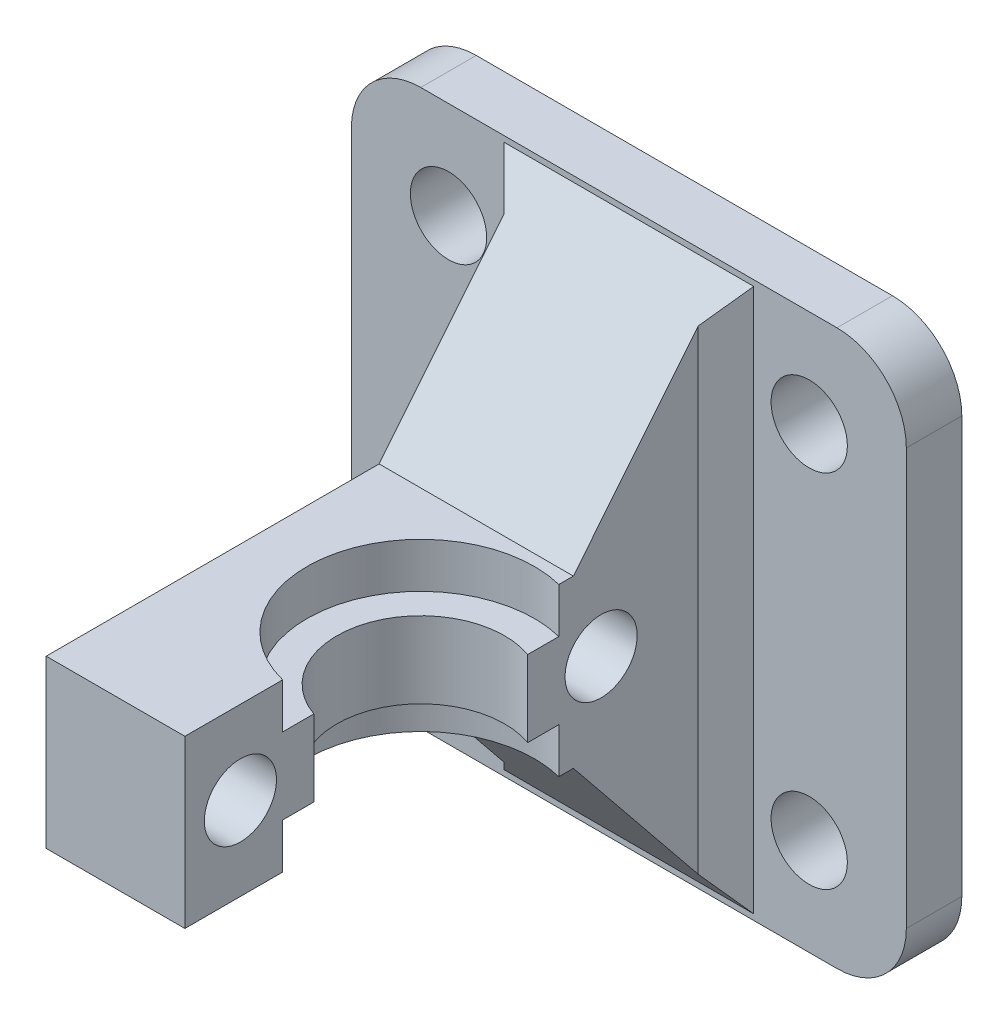
from build123d import *
from OCP.BRepFilletAPI import BRepFilletAPI_MakeChamfer

# Parameters (mm, degrees)
SKETCH1_W           = 40
SKETCH1_H           = 40
BOSS_EXTRUDE1_DEPTH = 4
CUT_EXTRUDE1_REACH  = 30.566
SKETCH2_R           = 2.75
BOSS_EXTRUDE2_DEPTH = 6
CHAMFER1_SIZE       = 11
CHAMFER1_SIZE2      = 13.583868722
SKETCH4_R           = 2.6
CUT_EXTRUDE2_DEPTH  = 7
BOSS_EXTRUDE3_DEPTH = 2.75
CHAMFER2_SIZE       = 2
FILLET1_R           = 5


with BuildPart() as part:
    # Sketch1 → Boss-Extrude1 (new body)
    with BuildSketch(Plane.XY):
        Rectangle(SKETCH1_W, SKETCH1_H)
    extrude(amount=BOSS_EXTRUDE1_DEPTH)

    # Sketch2 → Cut-Extrude1 (cut, up to next)
    with BuildSketch(Plane.XY, mode=Mode.PRIVATE) as cut_extrude1_sk1:
        with Locations((-13, 13)):
            Circle(SKETCH2_R)
    cut_extrude1_tool1 = extrude(cut_extrude1_sk1.sketch, amount=CUT_EXTRUDE1_REACH, mode=Mode.PRIVATE) & part.part
    # Sketch2 → Cut-Extrude1 (cut, up to next)
    with BuildSketch(Plane.XY, mode=Mode.PRIVATE) as cut_extrude1_sk2:
        with Locations(Location((13, 13, 0), (0, 0, 180))):
            Circle(SKETCH2_R)
    cut_extrude1_tool2 = extrude(cut_extrude1_sk2.sketch, amount=CUT_EXTRUDE1_REACH, mode=Mode.PRIVATE) & part.part
    # Sketch2 → Cut-Extrude1 (cut, up to next)
    with BuildSketch(Plane.XY, mode=Mode.PRIVATE) as cut_extrude1_sk3:
        with Locations((13, -13)):
            Circle(SKETCH2_R)
    cut_extrude1_tool3 = extrude(cut_extrude1_sk3.sketch, amount=CUT_EXTRUDE1_REACH, mode=Mode.PRIVATE) & part.part
    # Sketch2 → Cut-Extrude1 (cut, up to next)
    with BuildSketch(Plane.XY, mode=Mode.PRIVATE) as cut_extrude1_sk4:
        with Locations(Location((-13, -13, 0), (0, 0, 180))):
            Circle(SKETCH2_R)
    cut_extrude1_tool4 = extrude(cut_extrude1_sk4.sketch, amount=CUT_EXTRUDE1_REACH, mode=Mode.PRIVATE) & part.part
    add(cut_extrude1_tool1.solids().sort_by_distance((-13, 13, 0))[0], mode=Mode.SUBTRACT)
    add(cut_extrude1_tool2.solids().sort_by_distance((13, 13, 0))[0], mode=Mode.SUBTRACT)
    add(cut_extrude1_tool3.solids().sort_by_distance((13, -13, 0))[0], mode=Mode.SUBTRACT)
    add(cut_extrude1_tool4.solids().sort_by_distance((-13, -13, 0))[0], mode=Mode.SUBTRACT)

    # Sketch3 → Boss-Extrude2 (add, symmetric)
    with BuildSketch(Plane(origin=(0, 0, 0), x_dir=(1, 0, 0), z_dir=(0, 1, 0))):
        with BuildLine():
            Line((-7, -4), (-7, -39))
            Line((-7, -39), (3, -39))
            Line((3, -39), (3, -31.952358141))
            ThreePointArc((3, -31.952358141), (-2.952358141, -22), (7, -16.047641859))
            Line((7, -16.047641859), (7, -4))
            Line((7, -4), (-7, -4))
        make_face()
    extrude(amount=BOSS_EXTRUDE2_DEPTH, both=True)

    # Chamfer1: one chamfer whose edges measure the first distance from different faces: ONE call of the kernel's chamfer builder (chamfer() names one face for all edges)
    chamfer1_edges_1 = [part.edges().sort_by_distance(p)[0] for p in [
        (0, -6, 4),
    ]]
    chamfer1_side_1 = [part.faces().sort_by_distance(p)[0] for p in [
        (6.623038464, -6, 10.02382093),
    ]]
    chamfer1_edges_2 = [part.edges().sort_by_distance(p)[0] for p in [
        (0, 6, 4),
    ]]
    chamfer1_side_2 = [part.faces().sort_by_distance(p)[0] for p in [
        (6.623038464, 6, 10.02382093),
    ]]
    chamfer1 = BRepFilletAPI_MakeChamfer(part.part.solid().wrapped)
    for e in chamfer1_edges_1:
        chamfer1.Add(CHAMFER1_SIZE, CHAMFER1_SIZE2, e.wrapped, chamfer1_side_1[0].wrapped)  # the first distance lies on this face
    for e in chamfer1_edges_2:
        chamfer1.Add(CHAMFER1_SIZE, CHAMFER1_SIZE2, e.wrapped, chamfer1_side_2[0].wrapped)  # the first distance lies on this face
    add(Compound.cast(chamfer1.Shape()), mode=Mode.REPLACE)

    # Sketch4 → Cut-Extrude2 (cut, symmetric)
    with BuildSketch(Plane(origin=(0, 0, 0), x_dir=(0, 0, -1), z_dir=(1, 0, 0))):
        with Locations((-13, 0)):
            Circle(SKETCH4_R)
        with Locations((-35, 0)):
            Circle(SKETCH4_R)
    extrude(amount=CUT_EXTRUDE2_DEPTH, both=True, mode=Mode.SUBTRACT)

    # Sketch5 → Boss-Extrude3 (add, symmetric)
    with BuildSketch(Plane(origin=(0, 0, 0), x_dir=(1, 0, 0), z_dir=(0, 1, 0))):
        with BuildLine():
            Line((7, -15.738644179), (7, -18.290140107))
            ThreePointArc((7, -18.290140107), (-0.709859893, -22), (3, -29.709859893))
            Line((3, -29.709859893), (3, -32.261355821))
            ThreePointArc((3, -32.261355821), (-3.261355821, -22), (7, -15.738644179))
        make_face()
    extrude(amount=BOSS_EXTRUDE3_DEPTH, both=True)

    # Chamfer2
    chamfer2_edges = [part.edges().sort_by_distance(p)[0] for p in [
        (7, 0, 4),
        (-7, 0, 4),
    ]]
    chamfer(chamfer2_edges, length=CHAMFER2_SIZE)

    # Fillet1
    fillet1_edges = [part.edges().sort_by_distance(p)[0] for p in [
        (20, -20, 2),
        (-20, -20, 2),
        (-20, 20, 2),
        (20, 20, 2),
    ]]
    fillet(fillet1_edges, radius=FILLET1_R)


solid = part.part
